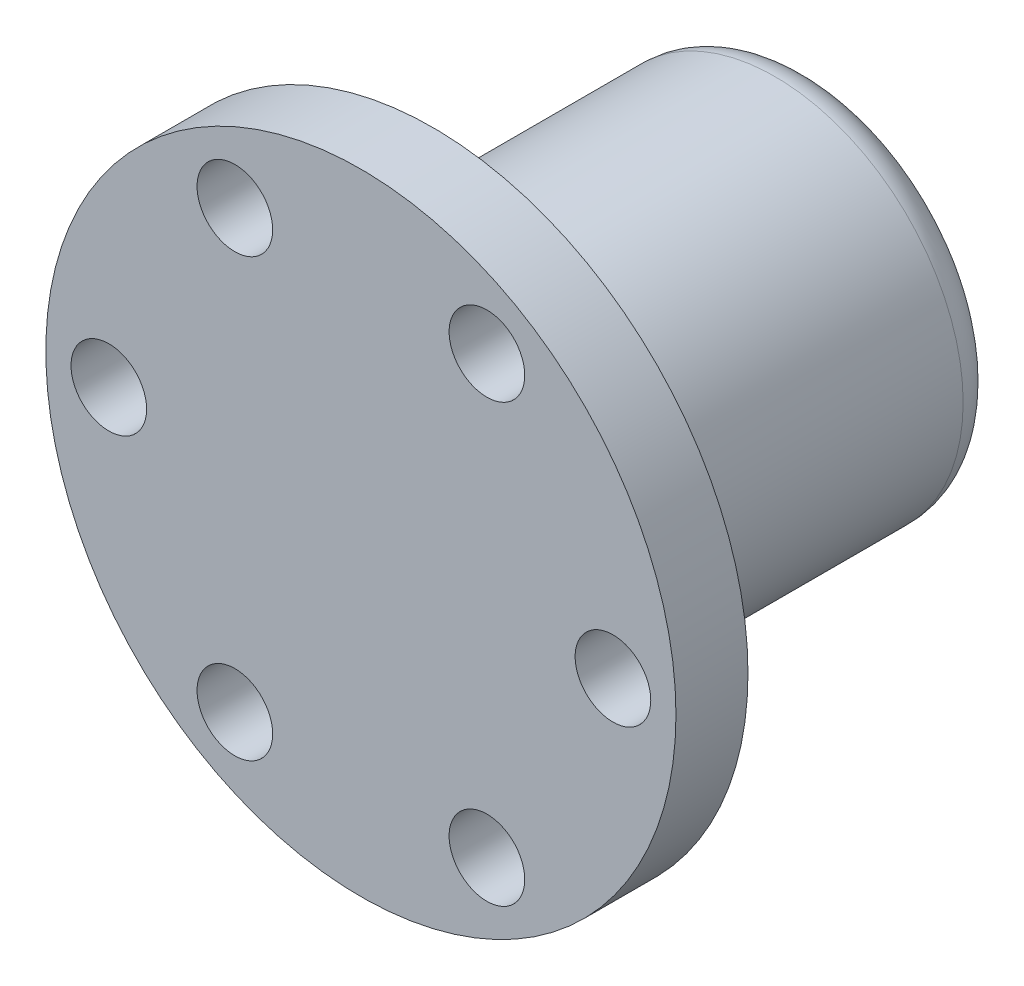
from build123d import *

# Parameters (mm, degrees)
SKETCH1_R           = 10.45
BOSS_EXTRUDE1_DEPTH = 21
SKETCH2_R           = 17.5
BOSS_EXTRUDE2_DEPTH = 4
SKETCH3_R           = 2.1
CUT_EXTRUDE1_DEPTH  = 36.178118199
FILLET1_R           = 2


with BuildPart() as part:
    # Sketch1 → Boss-Extrude1 (new body)
    with BuildSketch(Plane.XY):
        with Locations(Location((0, 0, 0), (0, 0, 180))):
            Circle(SKETCH1_R)
    extrude(amount=BOSS_EXTRUDE1_DEPTH)

    # Sketch2 → Boss-Extrude2 (add)
    with BuildSketch(Plane.XY.offset(21)):
        Circle(SKETCH2_R)
    extrude(amount=BOSS_EXTRUDE2_DEPTH)

    # Sketch3 → Cut-Extrude1 (cut, through all)
    with BuildSketch(Plane.XY.offset(25)):
        with Locations((14, 0)):
            Circle(SKETCH3_R)
        with Locations((7, -12.124355653)):
            Circle(SKETCH3_R)
        with Locations((-7, -12.124355653)):
            Circle(SKETCH3_R)
        with Locations((-14, 0)):
            Circle(SKETCH3_R)
        with Locations((-7, 12.124355653)):
            Circle(SKETCH3_R)
        with Locations((7, 12.124355653)):
            Circle(SKETCH3_R)
    extrude(amount=-CUT_EXTRUDE1_DEPTH, mode=Mode.SUBTRACT)

    # Fillet1
    fillet1_edges = [part.edges().sort_by_distance(p)[0] for p in [
        (10.45, 0, 0),
    ]]
    fillet(fillet1_edges, radius=FILLET1_R)


solid = part.part
